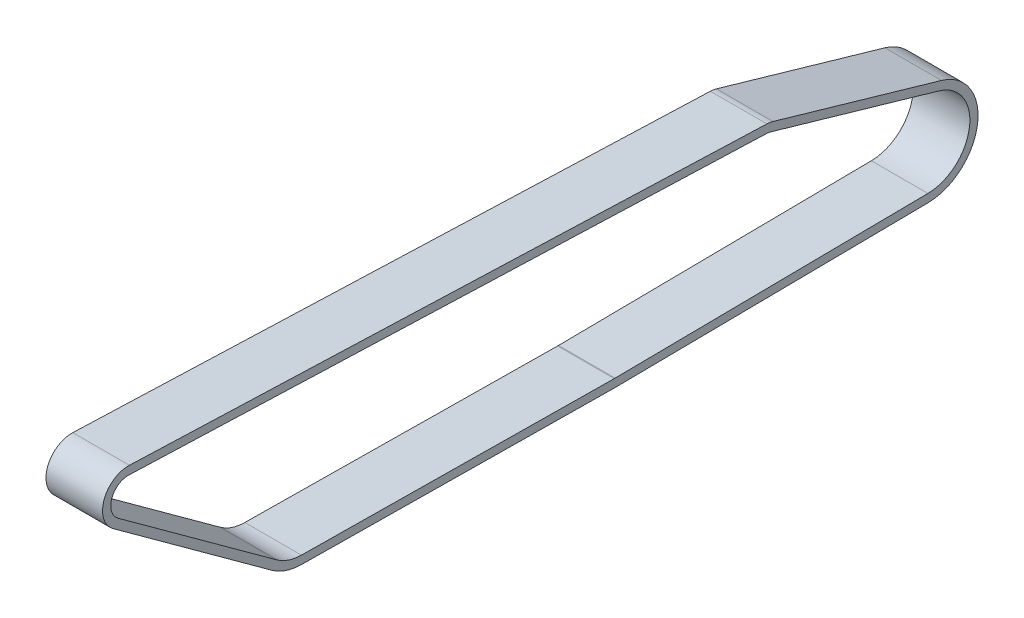
from build123d import *

# Parameters (mm, degrees)
EXTRUDE_THIN1_DEPTH = 50.8


with BuildPart() as part:
    # Sketch1 → Extrude-Thin1 (new body)
    with BuildSketch(Plane(origin=(0, 0, 0), x_dir=(0, 0, -1), z_dir=(1, 0, 0))):
        with BuildLine():
            Line((737.113874036, 8.511904093), (456.21754645, 5.336904093))
            ThreePointArc((456.21754645, 5.336904093), (455.703672415, 5.334), (455.189798379, 5.336904093))
            Line((455.189798379, 5.336904093), (174.293470793, 8.511904093))
            ThreePointArc((174.293470793, 8.511904093), (160.502158444, 10.818090953), (148.063879552, 17.206205881))
            Line((148.063879552, 17.206205881), (5.379457693, 120.98648949))
            ThreePointArc((5.379457693, 120.98648949), (-2.917750189, 147.368675717), (19.892164793, 163.00744764))
            Line((19.892164793, 163.00744764), (592.464987809, 142.245967303))
            ThreePointArc((592.464987809, 142.245967303), (595.219854288, 141.976498391), (597.921135385, 141.372359959))
            Line((597.921135385, 141.372359959), (749.221113821, 97.654109903))
            ThreePointArc((749.221113821, 97.654109903), (781.652360545, 47.85601599), (737.113874036, 8.511904093))
        make_face()
        with BuildLine():
            Line((737.0306207, 15.877433597), (456.134293115, 12.702433597))
            ThreePointArc((456.134293115, 12.702433597), (455.703672415, 12.7), (455.273051714, 12.702433597))
            Line((455.273051714, 12.702433597), (174.376724129, 15.877433597))
            ThreePointArc((174.376724129, 15.877433597), (162.819758473, 17.809992419), (152.396619736, 23.163161353))
            Line((152.396619736, 23.163161353), (9.712197878, 126.943444962))
            ThreePointArc((9.712197878, 126.943444962), (4.044706155, 144.96406397), (19.625249176, 155.646285228))
            Line((19.625249176, 155.646285228), (592.198072192, 134.884804891))
            ThreePointArc((592.198072192, 134.884804891), (594.055285548, 134.703140457), (595.876373928, 134.29585612))
            Line((595.876373928, 134.29585612), (747.176352364, 90.577606064))
            ThreePointArc((747.176352364, 90.577606064), (774.353374758, 48.847359768), (737.0306207, 15.877433597))
        make_face(mode=Mode.SUBTRACT)
    extrude(amount=EXTRUDE_THIN1_DEPTH)


solid = part.part
